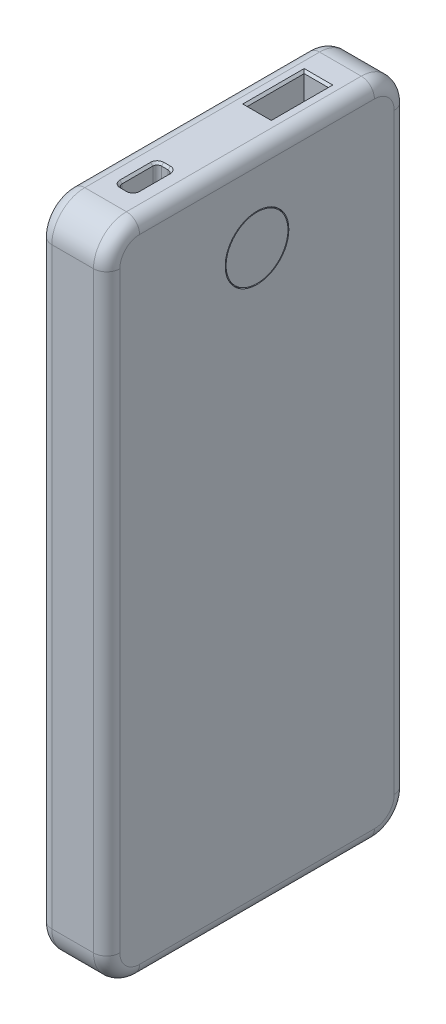
from build123d import *

# Parameters (mm, degrees)
SKETCH_1_W          = 15.5
SKETCH_1_H          = 68.5
EXTRUDE_1_DEPTH     = 150
SKETCH_2_W          = 5.5
SKETCH_2_H          = 13
CUT_EXTRUDE_1_DEPTH = 10
CHAMFER_1_SIZE      = 0.5
FILLET_1_R          = 7.5
FILLET_2_R          = 3
SKETCH_3_R          = 7.25
SKETCH_3_R_2        = 7.05
CUT_EXTRUDE_2_DEPTH = 0.5


with BuildPart() as part:
    # ｽｹｯﾁ1 → ﾎﾞｽ - 押し出し1 (new body)
    with BuildSketch(Plane(origin=(0, 0, 0), x_dir=(1, 0, 0), z_dir=(0, 1, 0))):
        Rectangle(SKETCH_1_W, SKETCH_1_H)
    extrude(amount=EXTRUDE_1_DEPTH)

    # ｽｹｯﾁ2 → ｶｯﾄ - 押し出し1 (cut)
    with BuildSketch(Plane(origin=(0, 150, 0), x_dir=(1, 0, 0), z_dir=(0, 1, 0))):
        with Locations((0, 14.75)):
            Rectangle(SKETCH_2_W, SKETCH_2_H)
        with BuildLine():
            Line((-0.75, -13.25), (0.75, -13.25))
            ThreePointArc((0.75, -13.25), (1.457106781, -13.542893219), (1.75, -14.25))
            Line((1.75, -14.25), (1.75, -21.25))
            ThreePointArc((1.75, -21.25), (1.457106781, -21.957106781), (0.75, -22.25))
            Line((0.75, -22.25), (-0.75, -22.25))
            ThreePointArc((-0.75, -22.25), (-1.457106781, -21.957106781), (-1.75, -21.25))
            Line((-1.75, -21.25), (-1.75, -14.25))
            ThreePointArc((-1.75, -14.25), (-1.457106781, -13.542893219), (-0.75, -13.25))
        make_face()
    extrude(amount=-CUT_EXTRUDE_1_DEPTH, mode=Mode.SUBTRACT)

    # 面取り1
    chamfer_1_edges = [part.edges().sort_by_distance(p)[0] for p in [
        (2.75, 150, -14.75),
        (0, 150, -21.25),
        (-2.75, 150, -14.75),
        (0, 150, -8.25),
        (1.457106781, 150, 21.957106781),
        (1.75, 150, 17.75),
        (1.457106781, 150, 13.542893219),
        (0, 150, 13.25),
        (-1.457106781, 150, 13.542893219),
        (-1.75, 150, 17.75),
        (-1.457106781, 150, 21.957106781),
        (0, 150, 22.25),
    ]]
    chamfer(chamfer_1_edges, length=CHAMFER_1_SIZE)

    # ﾌｨﾚｯﾄ1
    fillet_1_edges = [part.edges().sort_by_distance(p)[0] for p in [
        (0, 150, 34.25),
        (0, 0, 34.25),
        (0, 0, -34.25),
        (0, 150, -34.25),
    ]]
    fillet(fillet_1_edges, radius=FILLET_1_R)

    # ﾌｨﾚｯﾄ2
    fillet_2_edges = [part.edges().sort_by_distance(p)[0] for p in [
        (-7.75, 75, -34.25),
        (7.75, 75, -34.25),
        (-7.75, 0, 0),
        (-7.75, 75, 34.25),
        (-7.75, 150, 0),
        (-7.75, 147.803300859, 32.053300859),
        (-7.75, 147.803300859, -32.053300859),
        (-7.75, 2.196699141, 32.053300859),
        (-7.75, 2.196699141, -32.053300859),
        (7.75, 0, 0),
        (7.75, 150, 0),
        (7.75, 75, 34.25),
        (7.75, 147.803300859, 32.053300859),
        (7.75, 147.803300859, -32.053300859),
        (7.75, 2.196699141, 32.053300859),
        (7.75, 2.196699141, -32.053300859),
    ]]
    fillet(fillet_2_edges, radius=FILLET_2_R)

    # ｽｹｯﾁ3 → ｶｯﾄ - 押し出し2 (cut)
    with BuildSketch(Plane(origin=(7.75, 0, 0), x_dir=(0, 0, -1), z_dir=(1, 0, 0))):
        with Locations((0, 131)):
            Circle(SKETCH_3_R)
        with Locations((0, 131)):
            Circle(SKETCH_3_R_2, mode=Mode.SUBTRACT)
    extrude(amount=-CUT_EXTRUDE_2_DEPTH, mode=Mode.SUBTRACT)


solid = part.part
